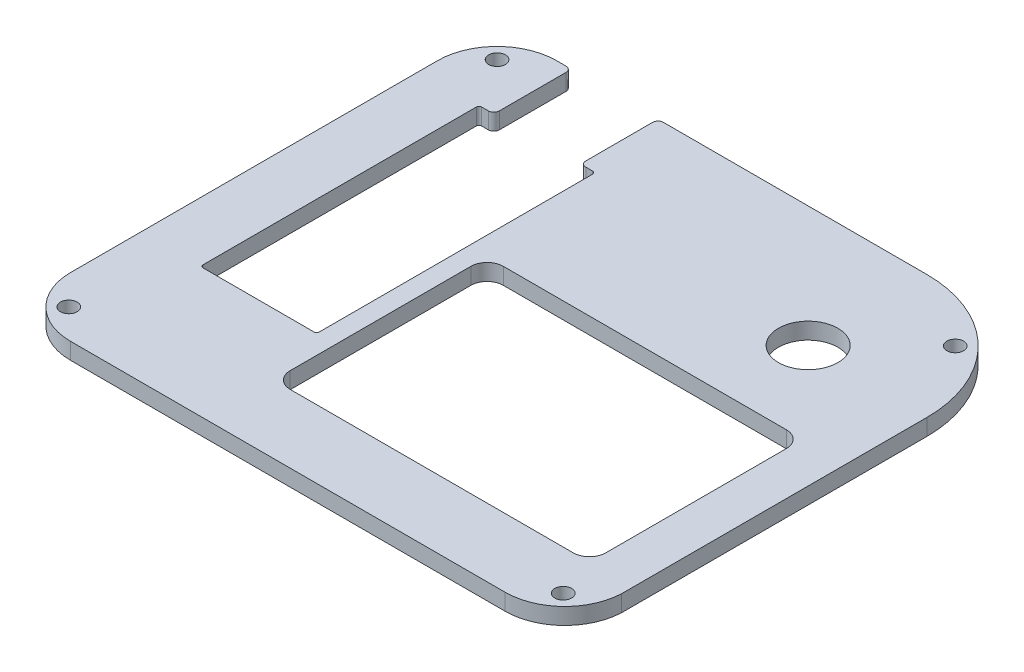
from build123d import *

# Parameters (mm, degrees)
SKETCH2_R           = 5.5
SKETCH2_R_2         = 1.55
BOSS_EXTRUDE1_DEPTH = 3.048


with BuildPart() as part:
    # Sketch2 → Boss-Extrude1 (new body)
    with BuildSketch(Plane(origin=(0, 0, 0), x_dir=(1, 0, 0), z_dir=(0, 1, 0))):
        with BuildLine():
            Line((3, -6.84), (3, -57.34))
            ThreePointArc((3, -57.34), (3.146446609, -57.693553391), (3.5, -57.84))
            Line((3.5, -57.84), (24, -57.84))
            ThreePointArc((24, -57.84), (24.353553391, -57.693553391), (24.5, -57.34))
            Line((24.5, -57.34), (24.5, -6.84))
            ThreePointArc((24.5, -6.84), (24.353553391, -6.486446609), (24, -6.34))
            Line((24, -6.34), (22.75, -6.34))
            ThreePointArc((22.75, -6.34), (22.042893219, -6.047106781), (21.75, -5.34))
            Line((21.75, -5.34), (21.75, 7))
            ThreePointArc((21.75, 7), (22.042893219, 7.707106781), (22.75, 8))
            Line((22.75, 8), (71.45, 8))
            ThreePointArc((71.45, 8), (87.628603154, 1.298603154), (94.33, -14.88))
            Line((94.33, -14.88), (94.33, -71.310147445))
            ThreePointArc((94.33, -71.310147445), (90.950189058, -78.782657675), (83.340051803, -81.84))
            Line((83.340051803, -81.84), (3, -81.84))
            ThreePointArc((3, -81.84), (-4.778174593, -78.618174593), (-8, -70.84))
            Line((-8, -70.84), (-8, -3))
            ThreePointArc((-8, -3), (-4.778174593, 4.778174593), (3, 8))
            Line((3, 8), (4.75, 8))
            ThreePointArc((4.75, 8), (5.457106781, 7.707106781), (5.75, 7))
            Line((5.75, 7), (5.75, -5.34))
            ThreePointArc((5.75, -5.34), (5.457106781, -6.047106781), (4.75, -6.34))
            Line((4.75, -6.34), (3.5, -6.34))
            ThreePointArc((3.5, -6.34), (3.146446609, -6.486446609), (3, -6.84))
        make_face()
        with Locations(Location((71.83, -14.33, 0), (0, 0, 90))):
            Circle(SKETCH2_R, mode=Mode.SUBTRACT)
        with Locations(Location((-2.656854249, 2.656854249, 0), (0, 0, 90))):
            Circle(SKETCH2_R_2, mode=Mode.SUBTRACT)
        with Locations(Location((85.50728281, -0.82271719, 0), (0, 0, 90))):
            Circle(SKETCH2_R_2, mode=Mode.SUBTRACT)
        with Locations(Location((88.858862501, -76.631761762, 0), (0, 0, 90))):
            Circle(SKETCH2_R_2, mode=Mode.SUBTRACT)
        with Locations(Location((-2.656854249, -76.496854249, 0), (0, 0, 90))):
            Circle(SKETCH2_R_2, mode=Mode.SUBTRACT)
        with BuildLine():
            Line((28, -66.24), (28, -32.84))
            ThreePointArc((28, -32.84), (28.878679656, -30.718679656), (31, -29.84))
            Line((31, -29.84), (83.33, -29.84))
            ThreePointArc((83.33, -29.84), (85.451320344, -30.718679656), (86.33, -32.84))
            Line((86.33, -32.84), (86.33, -66.24))
            ThreePointArc((86.33, -66.24), (85.451320344, -68.361320344), (83.33, -69.24))
            Line((83.33, -69.24), (31, -69.24))
            ThreePointArc((31, -69.24), (28.878679656, -68.361320344), (28, -66.24))
        make_face(mode=Mode.SUBTRACT)
    extrude(amount=BOSS_EXTRUDE1_DEPTH)


solid = part.part
